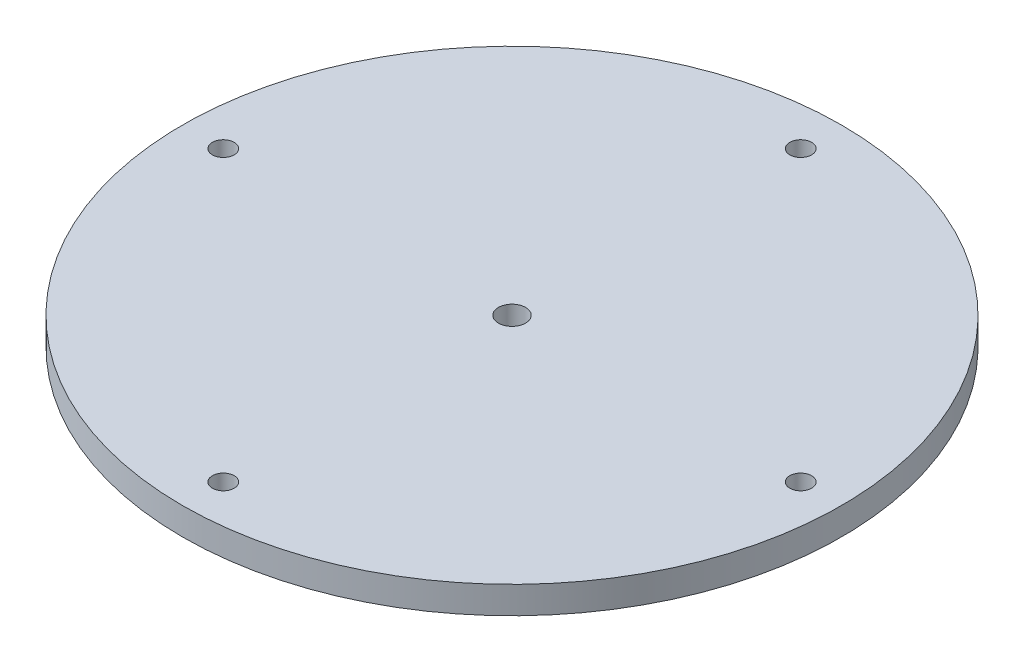
from build123d import *

# Parameters (mm, degrees)
SKETCH1_R           = 60.5
SKETCH1_R_2         = 2.5
BOSS_EXTRUDE1_DEPTH = 5
SKETCH2_R           = 5
CUT_EXTRUDE1_DEPTH  = 2
SKETCH4_R           = 2
CUT_EXTRUDE2_DEPTH  = 86.612499087


with BuildPart() as part:
    # Sketch1 → Boss-Extrude1 (new body)
    with BuildSketch(Plane(origin=(0, 0, 0), x_dir=(1, 0, 0), z_dir=(0, 1, 0))):
        with Locations(Location((0, 0, 0), (0, 0, 270))):
            Circle(SKETCH1_R)
        with Locations(Location((0, 0, 0), (0, 0, 270))):
            Circle(SKETCH1_R_2, mode=Mode.SUBTRACT)
    extrude(amount=BOSS_EXTRUDE1_DEPTH)

    # Sketch2 → Cut-Extrude1 (cut)
    with BuildSketch(Plane.XZ):
        with Locations(Location((0, 53, 0), (0, 0, 270))):
            Circle(SKETCH2_R)
        with Locations(Location((53, 0, 0), (0, 0, 270))):
            Circle(SKETCH2_R)
        with Locations(Location((0, -53, 0), (0, 0, 270))):
            Circle(SKETCH2_R)
        with Locations(Location((-53, 0, 0), (0, 0, 270))):
            Circle(SKETCH2_R)
    extrude(amount=-CUT_EXTRUDE1_DEPTH, mode=Mode.SUBTRACT)

    # Sketch4 → Cut-Extrude2 (cut, through all)
    with BuildSketch(Plane(origin=(0, 2, 0), x_dir=(-1, 0, 0), z_dir=(0, -1, 0))):
        with Locations(Location((0, -53, 0), (0, 0, 90))):
            Circle(SKETCH4_R)
        with Locations(Location((-53, 0, 0), (0, 0, 90))):
            Circle(SKETCH4_R)
        with Locations(Location((0, 53, 0), (0, 0, 90))):
            Circle(SKETCH4_R)
        with Locations(Location((53, 0, 0), (0, 0, 90))):
            Circle(SKETCH4_R)
    extrude(amount=-CUT_EXTRUDE2_DEPTH, mode=Mode.SUBTRACT)


solid = part.part
